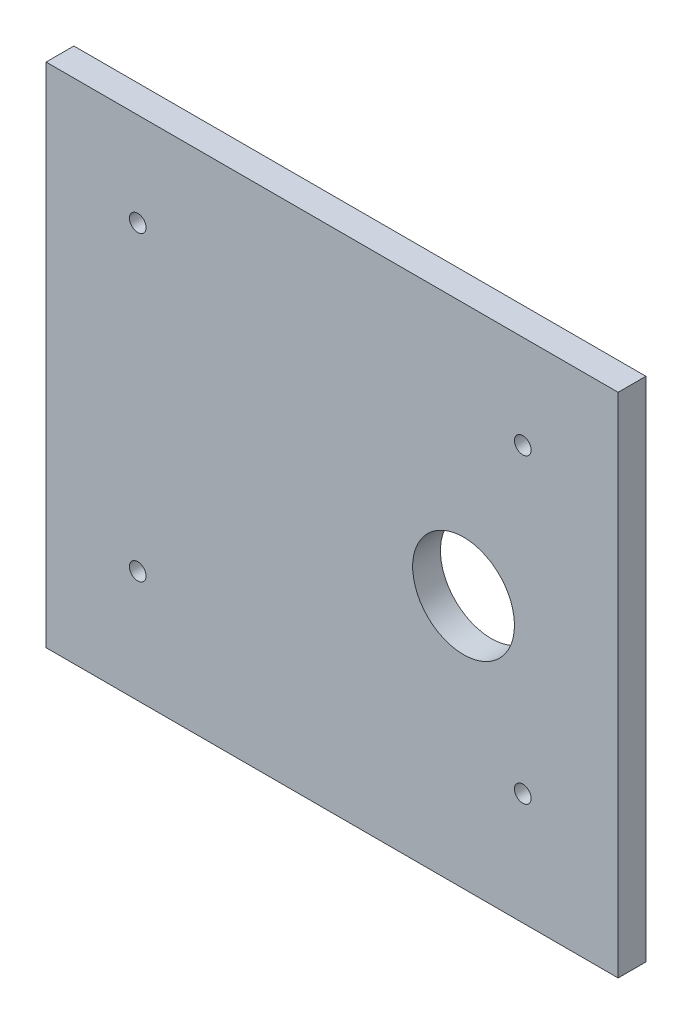
from build123d import *

# Parameters (mm, degrees)
CROQUIS2_W              = 274
CROQUIS2_H              = 309
CROQUIS2_R              = 27.5
CROQUIS2_R_2            = 4.5
SALIENTE_EXTRUIR1_DEPTH = 15


with BuildPart() as part:
    # Croquis2 → Saliente-Extruir1 (new body)
    with BuildSketch(Plane(origin=(0, 0, 0), x_dir=(0, 1, 0), z_dir=(0, 0, 1))):
        with Locations((137, 154.5)):
            Rectangle(CROQUIS2_W, CROQUIS2_H)
        with Locations(Location((137, 83.5, 0), (0, 0, 270))):
            Circle(CROQUIS2_R, mode=Mode.SUBTRACT)
        with Locations(Location((60.5, 51.5, 0), (0, 0, 270))):
            Circle(CROQUIS2_R_2, mode=Mode.SUBTRACT)
        with Locations(Location((223.5, 51.5, 0), (0, 0, 270))):
            Circle(CROQUIS2_R_2, mode=Mode.SUBTRACT)
        with Locations(Location((60.5, 259.5, 0), (0, 0, 270))):
            Circle(CROQUIS2_R_2, mode=Mode.SUBTRACT)
        with Locations(Location((223.5, 259.5, 0), (0, 0, 270))):
            Circle(CROQUIS2_R_2, mode=Mode.SUBTRACT)
    extrude(amount=SALIENTE_EXTRUIR1_DEPTH)


solid = part.part
